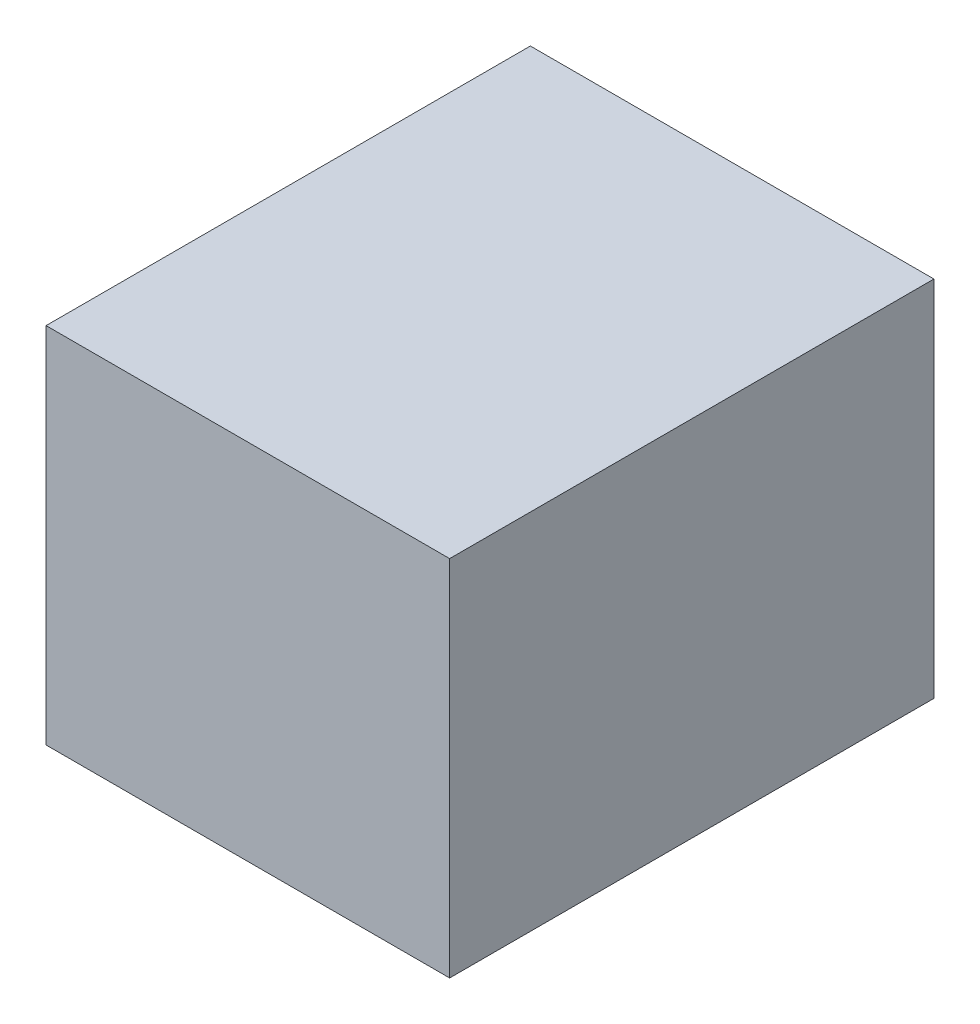
from build123d import *

# Parameters (mm, degrees)
SKETCH_1_W      = 100
SKETCH_1_H      = 90
EXTRUDE_2_DEPTH = 120


with BuildPart() as part:
    # Эскиз1 → Бобышка-Вытянуть2 (new body)
    with BuildSketch(Plane.XY):
        Rectangle(SKETCH_1_W, SKETCH_1_H)
    extrude(amount=EXTRUDE_2_DEPTH)


solid = part.part
